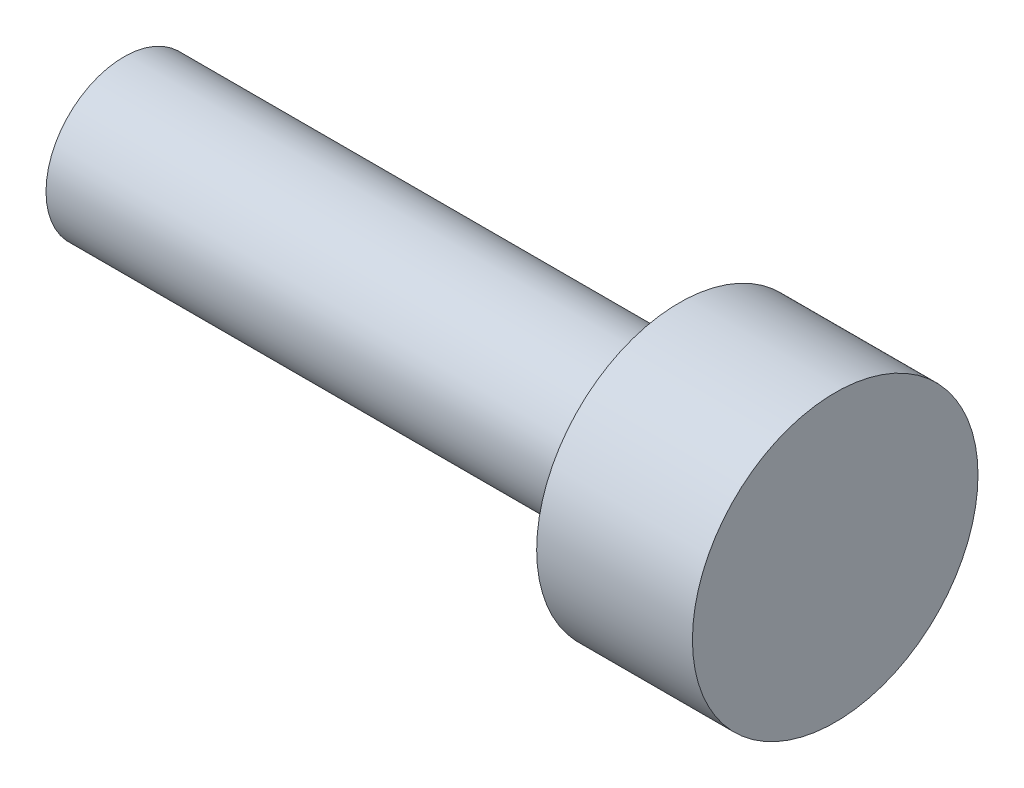
from build123d import *


with BuildPart() as part:
    # Axial profile (mm) → Full revolution (revolve)
    with BuildSketch(Plane.XY, mode=Mode.PRIVATE) as full_revolution_sk:
        Polygon((132, 0), (145.7, 0), (145.7, 2.75), (142.7, 2.75), (142.7, 1.5), (132, 1.5), align=None)
    revolve(full_revolution_sk.sketch.rotate(Axis((-110, 0, 0), (1, 0, 0)), 90), axis=Axis((-110, 0, 0), (1, 0, 0)))


solid = part.part
